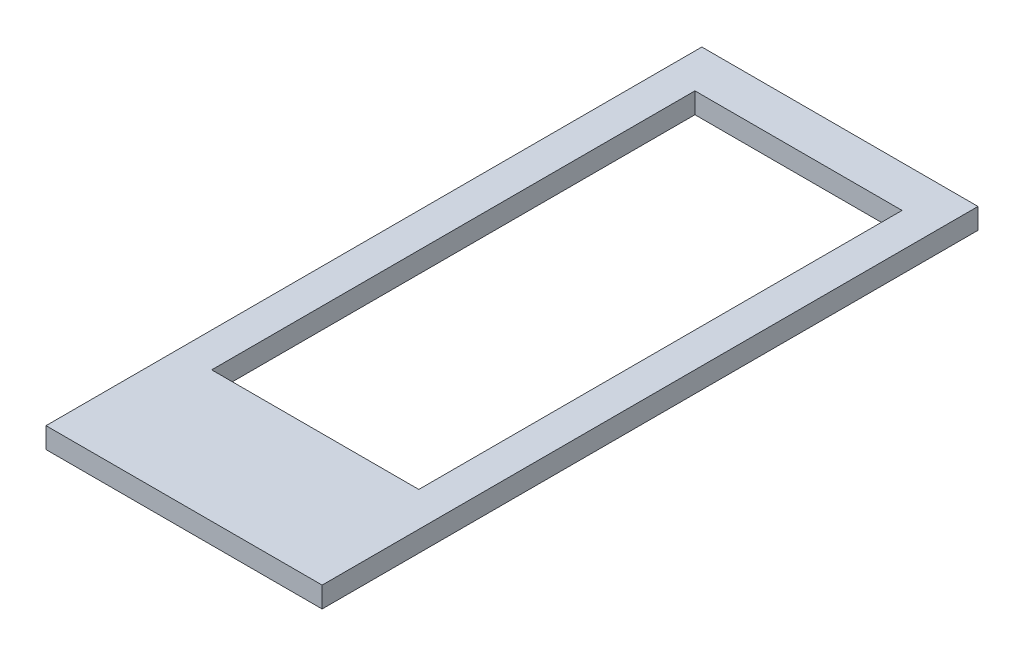
from build123d import *

# Parameters (mm, degrees)
CROQUIS2_W              = 40
CROQUIS2_H              = 95
CROQUIS2_W_2            = 30
CROQUIS2_H_2            = 70
SALIENTE_EXTRUIR1_DEPTH = 3


with BuildPart() as part:
    # Croquis2 → Saliente-Extruir1 (new body)
    with BuildSketch(Plane(origin=(0, 0, 0), x_dir=(1, 0, 0), z_dir=(0, 1, 0))):
        Rectangle(CROQUIS2_W, CROQUIS2_H)
        with Locations((0, 6.5)):
            Rectangle(CROQUIS2_W_2, CROQUIS2_H_2, mode=Mode.SUBTRACT)
    extrude(amount=SALIENTE_EXTRUIR1_DEPTH)


solid = part.part
